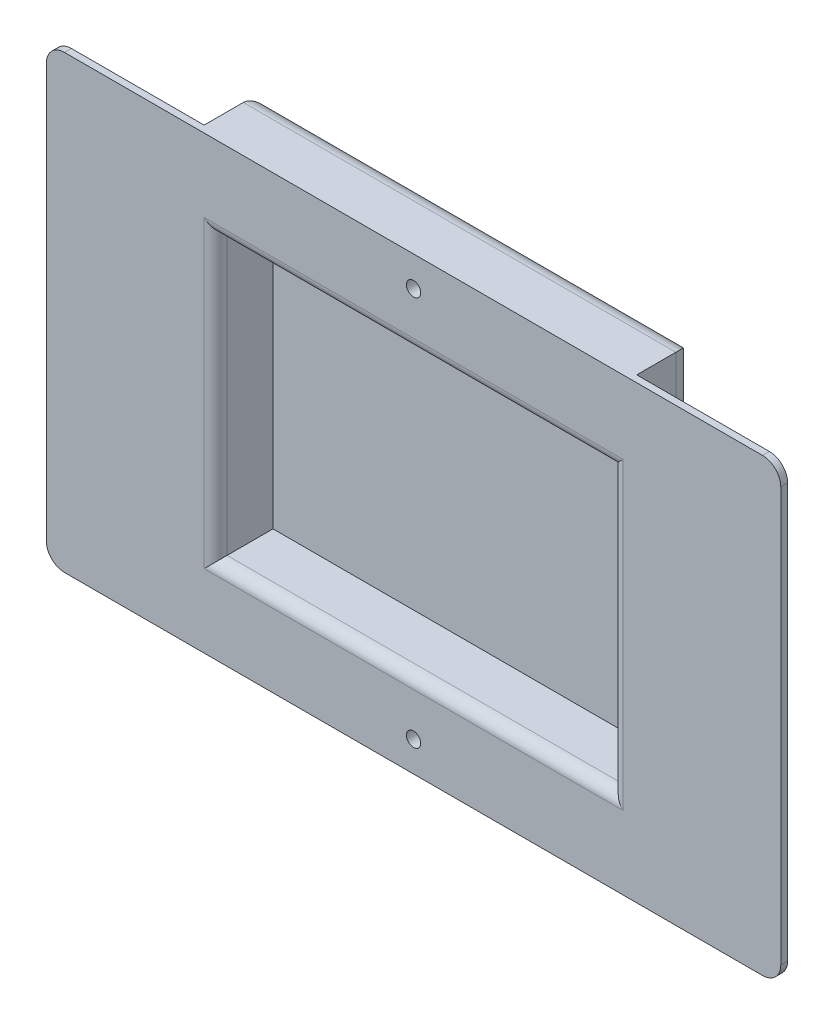
from build123d import *

# Parameters (mm, degrees)
SKETCH1_W           = 128
SKETCH1_H           = 78.5
BOSS_EXTRUDE1_DEPTH = 11.2
SKETCH2_W           = 69
SKETCH2_H           = 49
CUT_EXTRUDE1_DEPTH  = 10
FILLET2_R           = 2
SKETCH3_R           = 1.2446
CUT_EXTRUDE2_DEPTH  = 10
CUT_EXTRUDE3_REACH  = 103.9
SKETCH5_W           = 26.3
SKETCH5_H           = 10
FILLET3_R           = 3.175


with BuildPart() as part:
    # Sketch1 → Boss-Extrude1 (new body)
    with BuildSketch(Plane.XY):
        Rectangle(SKETCH1_W, SKETCH1_H)
    extrude(amount=BOSS_EXTRUDE1_DEPTH)

    # Sketch2 → Cut-Extrude1 (cut)
    with BuildSketch(Plane.XY.offset(11.2)):
        Rectangle(SKETCH2_W, SKETCH2_H)
    extrude(amount=-CUT_EXTRUDE1_DEPTH, mode=Mode.SUBTRACT)

    # Fillet2
    fillet2_edges = [part.edges().sort_by_distance(p)[0] for p in [
        (34.5, 0, 11.2),
        (0, 24.5, 11.2),
        (-34.5, 0, 11.2),
        (0, -24.5, 11.2),
    ]]
    fillet(fillet2_edges, radius=FILLET2_R)

    # Sketch3 → Cut-Extrude2 (cut)
    with BuildSketch(Plane.XY.offset(11.2)):
        with Locations((0, 34)):
            Circle(SKETCH3_R)
        with Locations(Location((0, -34, 0), (0, 0, 180))):
            Circle(SKETCH3_R)
    extrude(amount=-CUT_EXTRUDE2_DEPTH, mode=Mode.SUBTRACT)

    # Sketch5 → Cut-Extrude3 (cut, up to next)
    with BuildSketch(Plane.XZ.offset(39.25), mode=Mode.PRIVATE) as cut_extrude3_sk1:
        with Locations((50.85, 5)):
            Rectangle(SKETCH5_W, SKETCH5_H)
    cut_extrude3_tool1 = extrude(cut_extrude3_sk1.sketch, amount=-CUT_EXTRUDE3_REACH, mode=Mode.PRIVATE) & part.part
    # Sketch5 → Cut-Extrude3 (cut, up to next)
    with BuildSketch(Plane.XZ.offset(39.25), mode=Mode.PRIVATE) as cut_extrude3_sk2:
        with Locations((-50.85, 5)):
            Rectangle(SKETCH5_W, SKETCH5_H)
    cut_extrude3_tool2 = extrude(cut_extrude3_sk2.sketch, amount=-CUT_EXTRUDE3_REACH, mode=Mode.PRIVATE) & part.part
    add(cut_extrude3_tool1.solids().sort_by_distance((50.85, -39.25, 5))[0], mode=Mode.SUBTRACT)
    add(cut_extrude3_tool2.solids().sort_by_distance((-50.85, -39.25, 5))[0], mode=Mode.SUBTRACT)

    # Fillet3
    fillet3_edges = [part.edges().sort_by_distance(p)[0] for p in [
        (0, -39.25, 0),
        (0, 39.25, 0),
        (37.7, 0, 0),
        (-37.7, 0, 0),
        (64, -39.25, 10.6),
        (-64, -39.25, 10.6),
        (-64, 39.25, 10.6),
        (64, 39.25, 10.6),
    ]]
    fillet(fillet3_edges, radius=FILLET3_R)


solid = part.part
